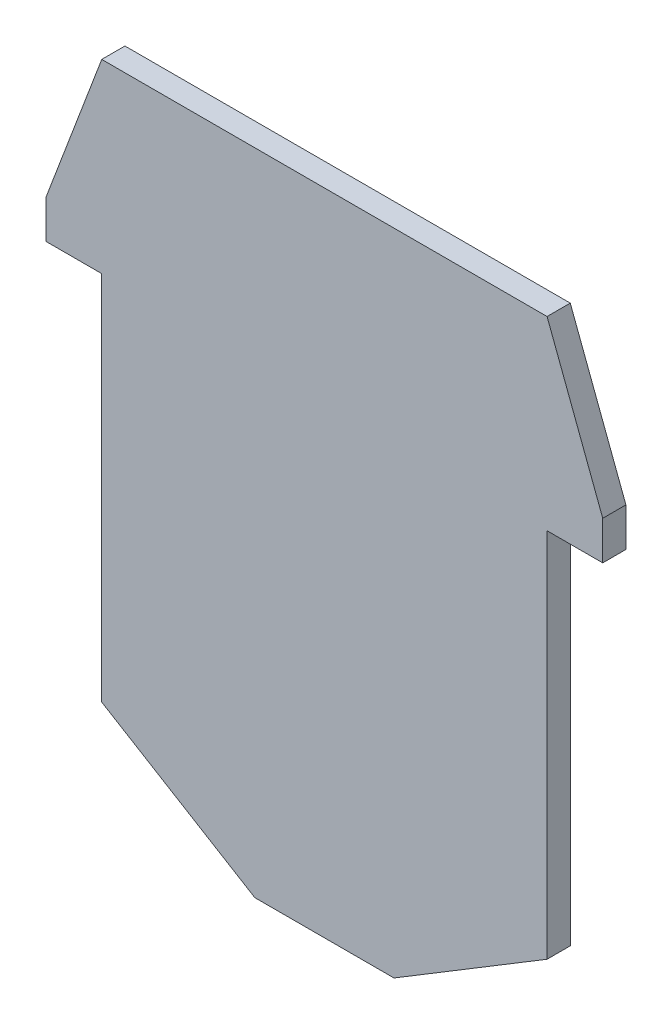
from build123d import *

# Parameters (mm, degrees)
SKETCH1_W           = 48
SKETCH1_H           = 80
BOSS_EXTRUDE1_DEPTH = 5


with BuildPart() as part:
    # Sketch1 → Boss-Extrude1 (new body)
    with BuildSketch(Plane.XY):
        Polygon((25.508982036, 41.676646707), (-22.491017964, 41.676646707), (-34.491017964, 10.002955871), (-34.491017964, 1.676646707), (-22.491017964, 1.676646707), (25.508982036, 1.676646707), align=None)
        Polygon((73.508982036, 41.676646707), (25.508982036, 41.676646707), (25.508982036, 1.676646707), (73.508982036, 1.676646707), (85.508982036, 1.676646707), (85.508982036, 10.002955871), align=None)
        with Locations((1.508982036, -38.323353293)):
            Rectangle(SKETCH1_W, SKETCH1_H)
        with Locations((49.508982036, -38.323353293)):
            Rectangle(SKETCH1_W, SKETCH1_H)
        Polygon((25.508982036, -98.323353293), (25.508982036, -78.323353293), (-22.491017964, -78.323353293), (10.508982036, -98.323353293), align=None)
        Polygon((73.508982036, -78.323353293), (25.508982036, -78.323353293), (25.508982036, -98.323353293), (40.508982036, -98.323353293), align=None)
    extrude(amount=BOSS_EXTRUDE1_DEPTH)


solid = part.part
